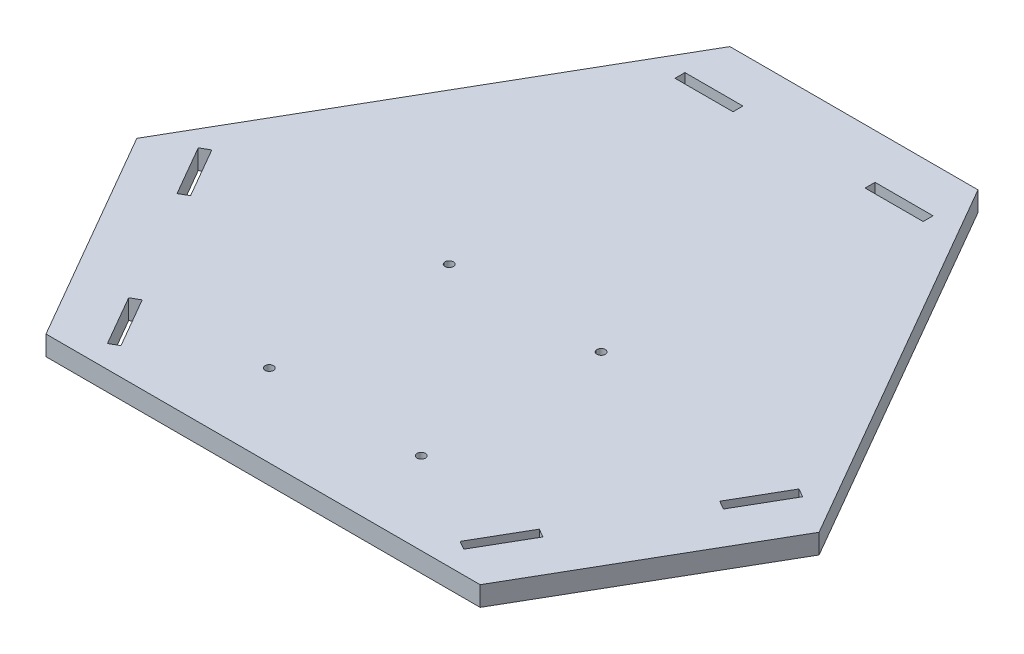
from build123d import *

# Parameters (mm, degrees)
SKETCH1_W           = 18.7
SKETCH1_H           = 3.2
BOSS_EXTRUDE1_DEPTH = 6.35
SKETCH2_R           = 1.35
CUT_EXTRUDE1_DEPTH  = 6.35


with BuildPart() as part:
    # Sketch1 → Boss-Extrude1 (new body)
    with BuildSketch(Plane(origin=(0, 0, 0), x_dir=(1, 0, 0), z_dir=(0, 1, 0))):
        Polygon((70, -86.602540378), (110, -17.320508076), (40, 103.923048454), (-40, 103.923048454), (-110, -17.320508076), (-70, -86.602540378), align=None)
        Polygon((-94.671350353, -8.470508076), (-85.321350353, -24.665183126), (-88.092631645, -26.265183126), (-97.442631645, -10.070508076), align=None, mode=Mode.SUBTRACT)
        Polygon((-57.442631645, -79.352540378), (-54.671350353, -77.752540378), (-64.021350353, -61.557865328), (-66.792631645, -63.157865328), align=None, mode=Mode.SUBTRACT)
        Polygon((54.671350353, -77.752540378), (64.021350353, -61.557865328), (66.792631645, -63.157865328), (57.442631645, -79.352540378), align=None, mode=Mode.SUBTRACT)
        Polygon((97.442631645, -10.070508076), (94.671350353, -8.470508076), (85.321350353, -24.665183126), (88.092631645, -26.265183126), align=None, mode=Mode.SUBTRACT)
        with Locations((30.65, 87.823048454)):
            Rectangle(SKETCH1_W, SKETCH1_H, mode=Mode.SUBTRACT)
        with Locations((-30.65, 87.823048454)):
            Rectangle(SKETCH1_W, SKETCH1_H, mode=Mode.SUBTRACT)
    extrude(amount=BOSS_EXTRUDE1_DEPTH)

    # Sketch2 → Cut-Extrude1 (cut)
    with BuildSketch(Plane(origin=(0, 6.35, 0), x_dir=(1, 0, 0), z_dir=(0, 1, 0))):
        with Locations(Location((-24.5, -60.102540378, 0), (0, 0, 270))):
            Circle(SKETCH2_R)
        with Locations(Location((24.5, -60.102540378, 0), (0, 0, 270))):
            Circle(SKETCH2_R)
        with Locations(Location((24.5, -2.102540378, 0), (0, 0, 270))):
            Circle(SKETCH2_R)
        with Locations(Location((-24.5, -2.102540378, 0), (0, 0, 270))):
            Circle(SKETCH2_R)
    extrude(amount=-CUT_EXTRUDE1_DEPTH, mode=Mode.SUBTRACT)


solid = part.part
